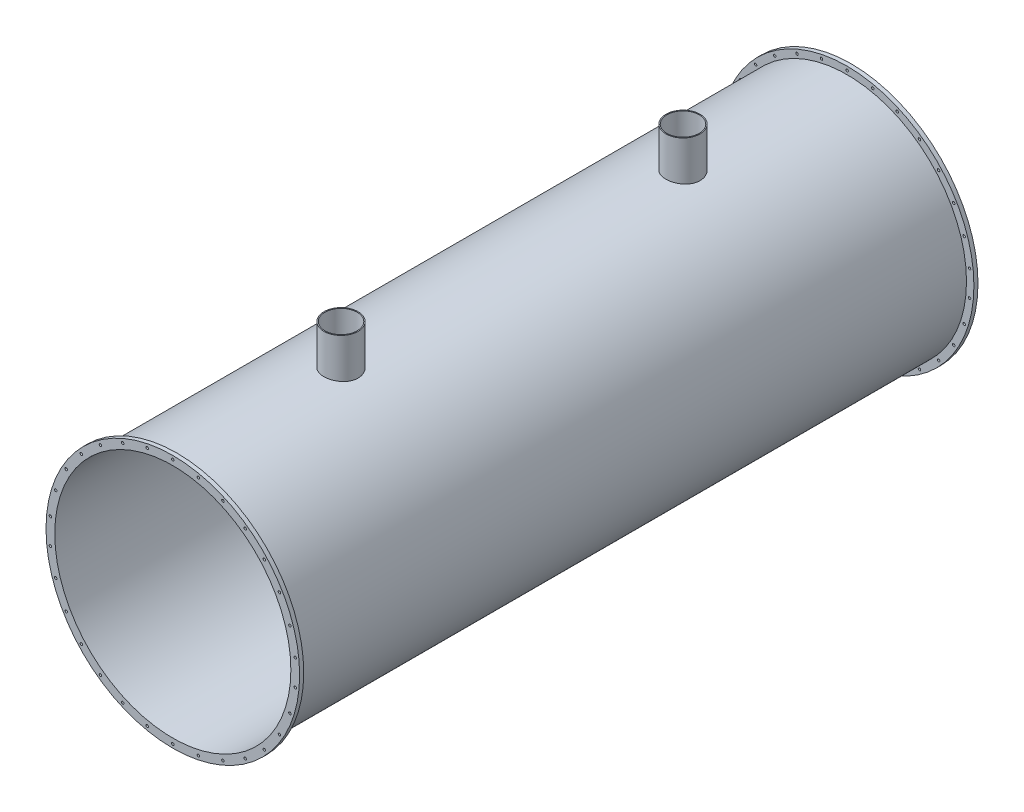
from build123d import *

# Parameters (mm, degrees)
SKETCH1_R           = 2130.0235
SKETCH1_R_2         = 2105.5785
BOSS_EXTRUDE1_DEPTH = 12100
SKETCH2_R           = 304.8
CUT_EXTRUDE2_DEPTH  = 2300
SKETCH4_R           = 304.8
CUT_EXTRUDE3_DEPTH  = 5000
BOSS_EXTRUDE2_START = -760
SKETCH5_R           = 304.8
BOSS_EXTRUDE2_DEPTH = 760
SKETCH6_R           = 287.4
CUT_EXTRUDE4_DEPTH  = 760
SKETCH7_R           = 2105.5785
CUT_EXTRUDE5_DEPTH  = 12608.776692364
SKETCH8_R           = 2262.0235
SKETCH8_R_2         = 2130.0235
BOSS_EXTRUDE3_DEPTH = 73
SKETCH9_R           = 22
CUT_EXTRUDE6_DEPTH  = 100
BOSS_EXTRUDE4_START = -73
SKETCH11_R          = 2262.0235
SKETCH11_R_2        = 2130.0235
BOSS_EXTRUDE4_DEPTH = 73
CUT_EXTRUDE7_START  = -1000
SKETCH12_R          = 22
CUT_EXTRUDE7_DEPTH  = 1000


with BuildPart() as part:
    # Sketch1 → Boss-Extrude1 (new body)
    with BuildSketch(Plane.XY):
        Circle(SKETCH1_R)
        Circle(SKETCH1_R_2, mode=Mode.SUBTRACT)
    extrude(amount=-BOSS_EXTRUDE1_DEPTH)

    # Sketch2 → Cut-Extrude2 (cut)
    with BuildSketch(Plane(origin=(0, 0, 0), x_dir=(1, 0, 0), z_dir=(0, 1, 0))):
        with Locations(Location((0, 3000, 0), (0, 0, 90))):
            Circle(SKETCH2_R)
    extrude(amount=CUT_EXTRUDE2_DEPTH, mode=Mode.SUBTRACT)

    # Sketch4 → Cut-Extrude3 (cut)
    with BuildSketch(Plane(origin=(0, 0, 0), x_dir=(1, 0, 0), z_dir=(0, 1, 0))):
        with Locations(Location((0, 9100, 0), (0, 0, 90))):
            Circle(SKETCH4_R)
    extrude(amount=CUT_EXTRUDE3_DEPTH, mode=Mode.SUBTRACT)

    # Sketch5 → Boss-Extrude2 (add)
    with BuildSketch(Plane(origin=(0, 2830.0235, 0), x_dir=(-1, 0, 0), z_dir=(0, 1, 0)).offset(BOSS_EXTRUDE2_START)):
        with Locations(Location((0, -3000, 0), (0, 0, 90))):
            Circle(SKETCH5_R)
        with Locations(Location((0, -9100, 0), (0, 0, 90))):
            Circle(SKETCH5_R)
    extrude(amount=BOSS_EXTRUDE2_DEPTH)

    # Sketch6 → Cut-Extrude4 (cut)
    with BuildSketch(Plane(origin=(0, 2830.0235, 0), x_dir=(-1, 0, 0), z_dir=(0, 1, 0))):
        with Locations(Location((0, -3000, 0), (0, 0, 90))):
            Circle(SKETCH6_R)
        with Locations(Location((0, -9100, 0), (0, 0, 90))):
            Circle(SKETCH6_R)
    extrude(amount=-CUT_EXTRUDE4_DEPTH, mode=Mode.SUBTRACT)

    # Sketch7 → Cut-Extrude5 (cut, through all)
    with BuildSketch(Plane.XY):
        Circle(SKETCH7_R)
    extrude(amount=-CUT_EXTRUDE5_DEPTH, mode=Mode.SUBTRACT)

    # Sketch8 → Boss-Extrude3 (add)
    with BuildSketch(Plane.XY):
        Circle(SKETCH8_R)
        Circle(SKETCH8_R_2, mode=Mode.SUBTRACT)
    extrude(amount=-BOSS_EXTRUDE3_DEPTH)

    # Sketch9 → Cut-Extrude6 (cut)
    with BuildSketch(Plane.XY):
        with Locations((0, 2196.0235)):
            Circle(SKETCH9_R)
        with Locations((456.578958961, 2148.03511768)):
            Circle(SKETCH9_R)
        with Locations((893.203226506, 2006.167293301)):
            Circle(SKETCH9_R)
        with Locations((1290.790226988, 1776.620331547)):
            Circle(SKETCH9_R)
        with Locations((1631.963500652, 1469.426536133)):
            Circle(SKETCH9_R)
        with Locations((1901.812138308, 1098.01175)):
            Circle(SKETCH9_R)
        with Locations((2088.542459612, 678.608581547)):
            Circle(SKETCH9_R)
        with Locations((2183.993453493, 229.546961755)):
            Circle(SKETCH9_R)
        with Locations((2183.993453493, -229.546961755)):
            Circle(SKETCH9_R)
        with Locations((2088.542459612, -678.608581547)):
            Circle(SKETCH9_R)
        with Locations((1901.812138308, -1098.01175)):
            Circle(SKETCH9_R)
        with Locations((1631.963500652, -1469.426536133)):
            Circle(SKETCH9_R)
        with Locations((1290.790226988, -1776.620331547)):
            Circle(SKETCH9_R)
        with Locations((893.203226506, -2006.167293301)):
            Circle(SKETCH9_R)
        with Locations((456.578958961, -2148.03511768)):
            Circle(SKETCH9_R)
        with Locations((0, -2196.0235)):
            Circle(SKETCH9_R)
        with Locations((-456.578958961, -2148.03511768)):
            Circle(SKETCH9_R)
        with Locations((-893.203226506, -2006.167293301)):
            Circle(SKETCH9_R)
        with Locations((-1290.790226988, -1776.620331547)):
            Circle(SKETCH9_R)
        with Locations((-1631.963500652, -1469.426536133)):
            Circle(SKETCH9_R)
        with Locations((-1901.812138308, -1098.01175)):
            Circle(SKETCH9_R)
        with Locations((-2088.542459612, -678.608581547)):
            Circle(SKETCH9_R)
        with Locations((-2183.993453493, -229.546961755)):
            Circle(SKETCH9_R)
        with Locations((-2183.993453493, 229.546961755)):
            Circle(SKETCH9_R)
        with Locations((-2088.542459612, 678.608581547)):
            Circle(SKETCH9_R)
        with Locations((-1901.812138308, 1098.01175)):
            Circle(SKETCH9_R)
        with Locations((-1631.963500652, 1469.426536133)):
            Circle(SKETCH9_R)
        with Locations((-1290.790226988, 1776.620331547)):
            Circle(SKETCH9_R)
        with Locations((-893.203226506, 2006.167293301)):
            Circle(SKETCH9_R)
        with Locations((-456.578958961, 2148.03511768)):
            Circle(SKETCH9_R)
    extrude(amount=-CUT_EXTRUDE6_DEPTH, mode=Mode.SUBTRACT)

    # Sketch11 → Boss-Extrude4 (add)
    with BuildSketch(Plane(origin=(0, 0, -12100), x_dir=(-1, 0, 0), z_dir=(0, 0, -1)).offset(BOSS_EXTRUDE4_START)):
        with Locations(Location((0, 0, 0), (0, 0, 180))):
            Circle(SKETCH11_R)
        with Locations(Location((0, 0, 0), (0, 0, 180))):
            Circle(SKETCH11_R_2, mode=Mode.SUBTRACT)
    extrude(amount=BOSS_EXTRUDE4_DEPTH)

    # Sketch12 → Cut-Extrude7 (cut)
    with BuildSketch(Plane(origin=(0, 0, -12100), x_dir=(-1, 0, 0), z_dir=(0, 0, -1)).offset(CUT_EXTRUDE7_START)):
        with Locations(Location((0, 2196.0235, 0), (0, 0, 180))):
            Circle(SKETCH12_R)
        with Locations(Location((456.578958961, 2148.03511768, 0), (0, 0, 180))):
            Circle(SKETCH12_R)
        with Locations(Location((893.203226506, 2006.167293301, 0), (0, 0, 180))):
            Circle(SKETCH12_R)
        with Locations(Location((1290.790226988, 1776.620331547, 0), (0, 0, 180))):
            Circle(SKETCH12_R)
        with Locations(Location((1631.963500652, 1469.426536133, 0), (0, 0, 180))):
            Circle(SKETCH12_R)
        with Locations(Location((1901.812138308, 1098.01175, 0), (0, 0, 180))):
            Circle(SKETCH12_R)
        with Locations(Location((2088.542459612, 678.608581547, 0), (0, 0, 180))):
            Circle(SKETCH12_R)
        with Locations(Location((2183.993453493, 229.546961755, 0), (0, 0, 180))):
            Circle(SKETCH12_R)
        with Locations(Location((2183.993453493, -229.546961755, 0), (0, 0, 180))):
            Circle(SKETCH12_R)
        with Locations(Location((2088.542459612, -678.608581547, 0), (0, 0, 180))):
            Circle(SKETCH12_R)
        with Locations(Location((1901.812138308, -1098.01175, 0), (0, 0, 180))):
            Circle(SKETCH12_R)
        with Locations(Location((1631.963500652, -1469.426536133, 0), (0, 0, 180))):
            Circle(SKETCH12_R)
        with Locations(Location((1290.790226988, -1776.620331547, 0), (0, 0, 180))):
            Circle(SKETCH12_R)
        with Locations(Location((893.203226506, -2006.167293301, 0), (0, 0, 180))):
            Circle(SKETCH12_R)
        with Locations(Location((456.578958961, -2148.03511768, 0), (0, 0, 180))):
            Circle(SKETCH12_R)
        with Locations(Location((0, -2196.0235, 0), (0, 0, 180))):
            Circle(SKETCH12_R)
        with Locations(Location((-456.578958961, -2148.03511768, 0), (0, 0, 180))):
            Circle(SKETCH12_R)
        with Locations(Location((-893.203226506, -2006.167293301, 0), (0, 0, 180))):
            Circle(SKETCH12_R)
        with Locations(Location((-1290.790226988, -1776.620331547, 0), (0, 0, 180))):
            Circle(SKETCH12_R)
        with Locations(Location((-1631.963500652, -1469.426536133, 0), (0, 0, 180))):
            Circle(SKETCH12_R)
        with Locations(Location((-1901.812138308, -1098.01175, 0), (0, 0, 180))):
            Circle(SKETCH12_R)
        with Locations(Location((-2088.542459612, -678.608581547, 0), (0, 0, 180))):
            Circle(SKETCH12_R)
        with Locations(Location((-2183.993453493, -229.546961755, 0), (0, 0, 180))):
            Circle(SKETCH12_R)
        with Locations(Location((-2183.993453493, 229.546961755, 0), (0, 0, 180))):
            Circle(SKETCH12_R)
        with Locations(Location((-2088.542459612, 678.608581547, 0), (0, 0, 180))):
            Circle(SKETCH12_R)
        with Locations(Location((-1901.812138308, 1098.01175, 0), (0, 0, 180))):
            Circle(SKETCH12_R)
        with Locations(Location((-1631.963500652, 1469.426536133, 0), (0, 0, 180))):
            Circle(SKETCH12_R)
        with Locations(Location((-1290.790226988, 1776.620331547, 0), (0, 0, 180))):
            Circle(SKETCH12_R)
        with Locations(Location((-893.203226506, 2006.167293301, 0), (0, 0, 180))):
            Circle(SKETCH12_R)
        with Locations(Location((-456.578958961, 2148.03511768, 0), (0, 0, 180))):
            Circle(SKETCH12_R)
    extrude(amount=CUT_EXTRUDE7_DEPTH, mode=Mode.SUBTRACT)


solid = part.part
